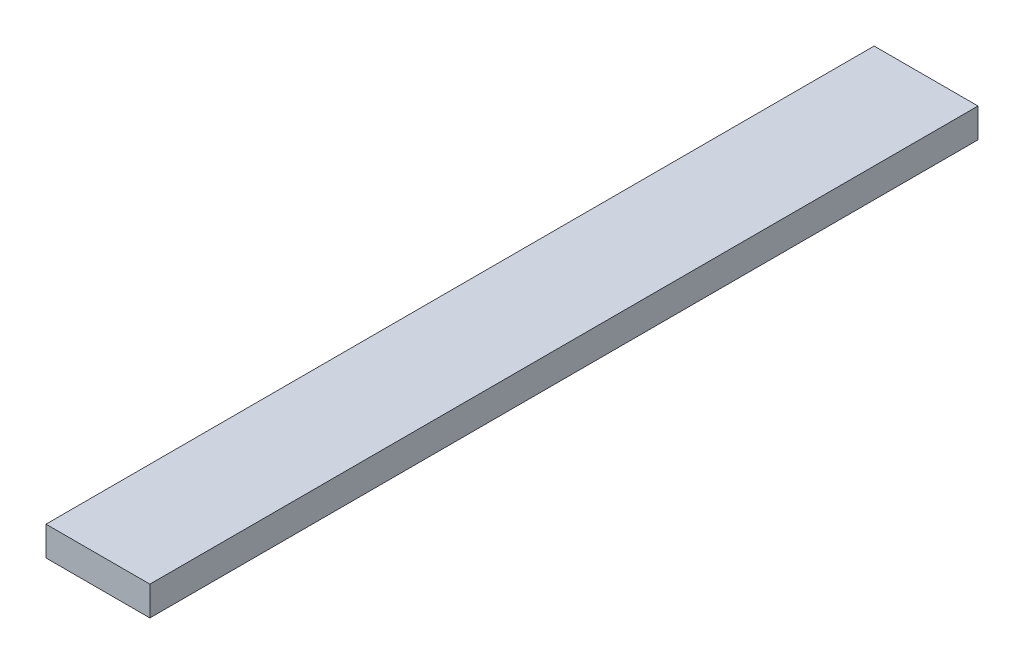
from build123d import *

# Parameters (mm, degrees)
SKETCH1_W           = 45
SKETCH1_H           = 12.7
BOSS_EXTRUDE1_DEPTH = 358.775


with BuildPart() as part:
    # Sketch1 → Boss-Extrude1 (new body)
    with BuildSketch(Plane.XY):
        with Locations((22.5, 6.35)):
            Rectangle(SKETCH1_W, SKETCH1_H)
    extrude(amount=BOSS_EXTRUDE1_DEPTH)


solid = part.part
